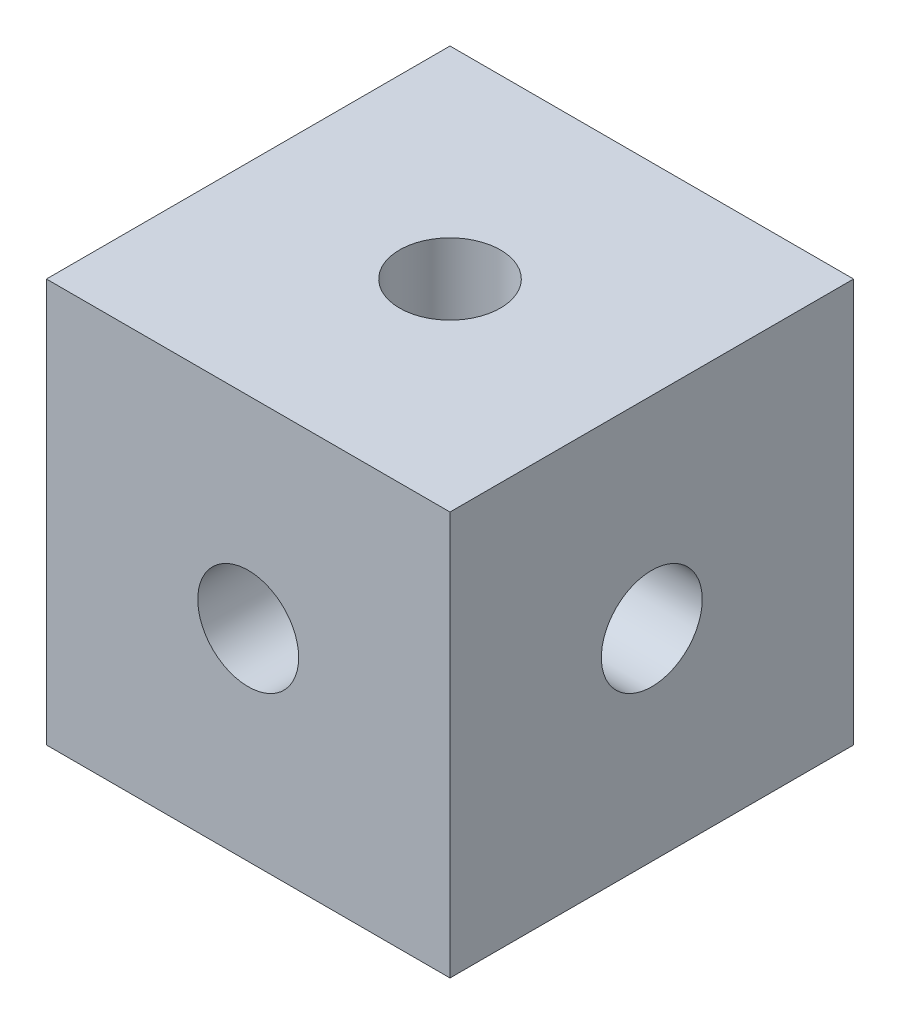
from build123d import *

# Parameters (mm, degrees)
SKETCH_1_W                   = 10
SKETCH_1_H                   = 10
EXTRUDE_1_DEPTH              = 5
HOLE_WIZARD_M3_1_D           = 2.5
HOLE_WIZARD_M3_1_ON_FACE_2_D = 2.5
HOLE_WIZARD_M3_1_ON_FACE_3_D = 2.5
HOLE_WIZARD_M3_1_ON_FACE_4_D = 2.5


with BuildPart() as part:
    # 草图1 → 凸台-拉伸1 (new, symmetric)
    with BuildSketch(Plane(origin=(0, 0, 0), x_dir=(1, 0, 0), z_dir=(0, 1, 0))):
        Rectangle(SKETCH_1_W, SKETCH_1_H)
    extrude(amount=EXTRUDE_1_DEPTH, both=True)

    # M3 螺纹孔1 (through all)
    with Locations(Plane(origin=(5, 0, 0), x_dir=(0, 0, 1), z_dir=(1, 0, 0))):
        with Locations((0, 0)):
            Hole(HOLE_WIZARD_M3_1_D / 2)

    # M3 螺纹孔1 on face 2 (through all)
    with Locations(Plane(origin=(0, 0, 0), x_dir=(0, 0, 1), z_dir=(1, 0, 0))):
        with Locations((0, 0)):
            Hole(HOLE_WIZARD_M3_1_ON_FACE_2_D / 2)

    # M3 螺纹孔1 on face 3 (through all)
    with Locations(Plane.XY.offset(5)):
        with Locations((0, 0)):
            Hole(HOLE_WIZARD_M3_1_ON_FACE_3_D / 2)

    # M3 螺纹孔1 on face 4 (through all)
    with Locations(Plane.ZX.offset(5)):
        with Locations((0, 0)):
            Hole(HOLE_WIZARD_M3_1_ON_FACE_4_D / 2)


solid = part.part
